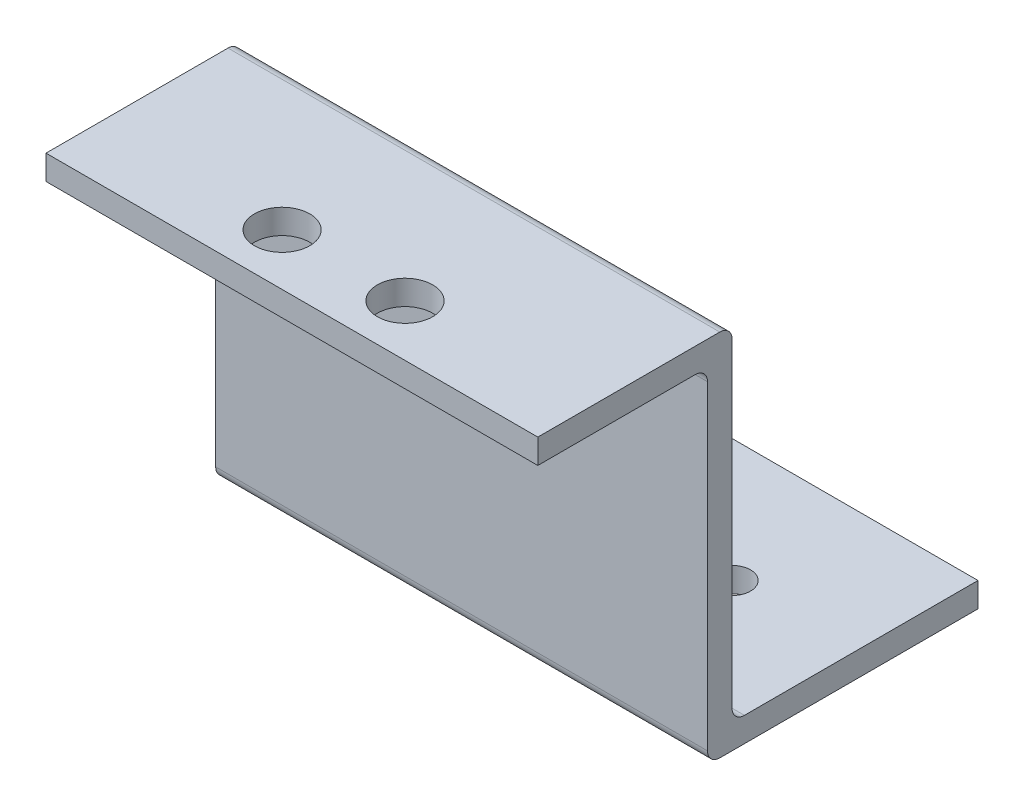
from build123d import *

# Parameters (mm, degrees)
SKETCH1_W           = 40
SKETCH1_H           = 100
SKETCH1_R           = 1.5
SKETCH1_R_2         = 2.25
BOSS_EXTRUDE1_DEPTH = 2
SKETCH2_W           = 40
SKETCH2_H           = 16
CUT_EXTRUDE1_DEPTH  = 10
SKETCH4_W           = 40
SKETCH4_H           = 2
BOSS_EXTRUDE2_DEPTH = 30
SKETCH5_W           = 40
SKETCH5_H           = 2
BOSS_EXTRUDE3_DEPTH = 20
SKETCH6_W           = 40
SKETCH6_H           = 2
BOSS_EXTRUDE4_DEPTH = 20
FILLET1_R           = 1
SKETCH7_R           = 1.5
CUT_EXTRUDE2_DEPTH  = 20
SKETCH8_R           = 1.5
CUT_EXTRUDE3_DEPTH  = 20
SKETCH9_R           = 2.25
CUT_EXTRUDE4_DEPTH  = 68.136662164
SKETCH10_W          = 1
SKETCH10_H          = 6.8
BOSS_EXTRUDE5_DEPTH = 2
BOSS_EXTRUDE6_START = -2
BOSS_EXTRUDE6_DEPTH = 2


with BuildPart() as part:
    # Sketch1 → Boss-Extrude1 (new body)
    with BuildSketch(Plane(origin=(0, 0, 0), x_dir=(1, 0, 0), z_dir=(0, 1, 0))):
        with Locations((0.735982487, -0.367991244)):
            Rectangle(SKETCH1_W, SKETCH1_H)
        with Locations(Location((-9.264017513, -40.367991244, 0), (0, 0, 270))):
            Circle(SKETCH1_R, mode=Mode.SUBTRACT)
        with Locations(Location((-4.264017513, -24.767991244, 0), (0, 0, 270))):
            Circle(SKETCH1_R_2, mode=Mode.SUBTRACT)
        with Locations(Location((10.735982487, -40.367991244, 0), (0, 0, 270))):
            Circle(SKETCH1_R, mode=Mode.SUBTRACT)
        with Locations(Location((5.735982487, -24.767991244, 0), (0, 0, 270))):
            Circle(SKETCH1_R_2, mode=Mode.SUBTRACT)
        with Locations(Location((-4.264017513, 24.032008756, 0), (0, 0, 270))):
            Circle(SKETCH1_R_2, mode=Mode.SUBTRACT)
        with Locations(Location((-9.264017513, 39.632008756, 0), (0, 0, 270))):
            Circle(SKETCH1_R, mode=Mode.SUBTRACT)
        Polygon((0.235982487, 26.632008756), (0.735982487, 26.632008756), (1.235982487, 26.632008756), (1.235982487, 19.832008756), (10.735982487, 19.832008756), (10.735982487, -20.567991244), (1.235982487, -20.567991244), (1.235982487, -27.367991244), (0.735982487, -27.367991244), (0.235982487, -27.367991244), (0.235982487, -20.567991244), (-9.264017513, -20.567991244), (-9.264017513, 19.832008756), (0.235982487, 19.832008756), align=None, mode=Mode.SUBTRACT)
        with Locations(Location((5.735982487, 24.032008756, 0), (0, 0, 270))):
            Circle(SKETCH1_R_2, mode=Mode.SUBTRACT)
        with Locations(Location((10.735982487, 39.632008756, 0), (0, 0, 270))):
            Circle(SKETCH1_R, mode=Mode.SUBTRACT)
    extrude(amount=BOSS_EXTRUDE1_DEPTH)

    # Sketch2 → Cut-Extrude1 (cut)
    with BuildSketch(Plane(origin=(0, 2, 0), x_dir=(1, 0, 0), z_dir=(0, 1, 0))):
        with Locations((0.735982487, 41.632008756)):
            Rectangle(SKETCH2_W, SKETCH2_H)
        with Locations((0.735982487, -42.367991244)):
            Rectangle(SKETCH2_W, SKETCH2_H)
    extrude(amount=-CUT_EXTRUDE1_DEPTH, mode=Mode.SUBTRACT)

    # Sketch4 → Boss-Extrude2 (add)
    with BuildSketch(Plane(origin=(0, 2, 0), x_dir=(1, 0, 0), z_dir=(0, 1, 0))):
        with Locations((0.735982487, -35.367991244)):
            Rectangle(SKETCH4_W, SKETCH4_H)
        with Locations((0.735982487, 34.632008756)):
            Rectangle(SKETCH4_W, SKETCH4_H)
    extrude(amount=-BOSS_EXTRUDE2_DEPTH)

    # Sketch5 → Boss-Extrude3 (add)
    with BuildSketch(Plane(origin=(0, 0, -35.632008756), x_dir=(-1, 0, 0), z_dir=(0, 0, -1))):
        with Locations((-0.735982487, -27)):
            Rectangle(SKETCH5_W, SKETCH5_H)
    extrude(amount=BOSS_EXTRUDE3_DEPTH)

    # Sketch6 → Boss-Extrude4 (add)
    with BuildSketch(Plane.XY.offset(36.367991244)):
        with Locations((0.735982487, -27)):
            Rectangle(SKETCH6_W, SKETCH6_H)
    extrude(amount=BOSS_EXTRUDE4_DEPTH)

    # Fillet1
    fillet1_edges = [part.edges().sort_by_distance(p)[0] for p in [
        (0.735982487, -28, 34.367991244),
        (0.735982487, 2, 36.367991244),
        (0.735982487, -28, -33.632008756),
        (0.735982487, 2, -35.632008756),
        (0.735982487, -26, -35.632008756),
        (0.735982487, -26, 36.367991244),
        (0.735982487, 0, 34.367991244),
        (0.735982487, 0, -33.632008756),
    ]]
    fillet(fillet1_edges, radius=FILLET1_R)

    # Sketch7 → Cut-Extrude2 (cut)
    with BuildSketch(Plane(origin=(0, -26, 0), x_dir=(1, 0, 0), z_dir=(0, 1, 0))):
        with Locations(Location((-9.264017513, 45.632008756, 0), (0, 0, 270))):
            Circle(SKETCH7_R)
        with Locations(Location((10.735982487, 45.632008756, 0), (0, 0, 270))):
            Circle(SKETCH7_R)
    extrude(amount=-CUT_EXTRUDE2_DEPTH, mode=Mode.SUBTRACT)

    # Sketch8 → Cut-Extrude3 (cut)
    with BuildSketch(Plane(origin=(0, -26, 0), x_dir=(1, 0, 0), z_dir=(0, 1, 0))):
        with Locations(Location((10.735982487, -46.367991244, 0), (0, 0, 270))):
            Circle(SKETCH8_R)
        with Locations(Location((-9.264017513, -46.367991244, 0), (0, 0, 270))):
            Circle(SKETCH8_R)
    extrude(amount=-CUT_EXTRUDE3_DEPTH, mode=Mode.SUBTRACT)

    # Sketch9 → Cut-Extrude4 (cut, through all)
    # profile 1 of 5: a face of its own
    with BuildSketch(Plane(origin=(0, 2, 0), x_dir=(1, 0, 0), z_dir=(0, 1, 0))):
        Polygon((36.675013235, 19.832008756), (20.735982487, 19.832008756), (20.735982487, -35.367991244), (10.735982487, -35.367991244), (10.735982487, -99.31179038), (10.735982487, -106.86631097), (36.675013235, -106.86631097), align=None)
    # profile 2 of 5: a face of its own
    with BuildSketch(Plane(origin=(0, 2, 0), x_dir=(1, 0, 0), z_dir=(0, 1, 0))):
        Polygon((10.735982487, -20.567991244), (10.735982487, 19.832008756), (1.235982487, 19.832008756), (0.235982487, 19.832008756), (-9.264017513, 19.832008756), (-9.264017513, -20.567991244), (0.235982487, -20.567991244), (0.235982487, -27.367991244), (1.235982487, -27.367991244), (1.235982487, -20.567991244), align=None)
    # profile 3 of 5: a face of its own
    with BuildSketch(Plane(origin=(0, 2, 0), x_dir=(1, 0, 0), z_dir=(0, 1, 0))):
        Polygon((10.735982487, -35.367991244), (10.735982487, -20.567991244), (1.235982487, -20.567991244), (1.235982487, -27.367991244), (0.235982487, -27.367991244), (0.235982487, -20.567991244), (-9.264017513, -20.567991244), (-9.264017513, 19.832008756), (-19.264017513, 19.832008756), (-19.264017513, -35.367991244), align=None)
        with Locations((-4.264017513, -24.767991244)):
            Circle(SKETCH9_R, mode=Mode.SUBTRACT)
        with Locations((5.735982487, -24.767991244)):
            Circle(SKETCH9_R, mode=Mode.SUBTRACT)
    # profile 4 of 5: a face of its own
    with BuildSketch(Plane(origin=(0, 2, 0), x_dir=(1, 0, 0), z_dir=(0, 1, 0))):
        Polygon((20.735982487, 19.832008756), (10.735982487, 19.832008756), (10.735982487, -20.567991244), (10.735982487, -35.367991244), (20.735982487, -35.367991244), align=None)
    # profile 5 of 5: a face of its own
    with BuildSketch(Plane(origin=(0, 2, 0), x_dir=(1, 0, 0), z_dir=(0, 1, 0))):
        Polygon((10.735982487, -99.31179038), (10.735982487, -35.367991244), (-19.264017513, -35.367991244), (-19.264017513, 19.832008756), (-32.318048619, 19.832008756), (-32.318048619, -99.31179038), align=None)
    extrude(amount=-CUT_EXTRUDE4_DEPTH, mode=Mode.SUBTRACT)

    # Sketch10 → Boss-Extrude5 (add)
    with BuildSketch(Plane(origin=(0, 2, 0), x_dir=(1, 0, 0), z_dir=(0, 1, 0))):
        with Locations((0.735982487, 23.232008756)):
            Rectangle(SKETCH10_W, SKETCH10_H)
    extrude(amount=-BOSS_EXTRUDE5_DEPTH)

    # Sketch11 → Boss-Extrude6 (add)
    with BuildSketch(Plane.ZY.offset(19.264017513).offset(BOSS_EXTRUDE6_START)):
        with BuildLine():
            Line((-35.632008756, -25), (-35.632008756, -16))
            Line((-35.632008756, -16), (-45.632008756, -26))
            Line((-45.632008756, -26), (-36.632008756, -26))
            ThreePointArc((-36.632008756, -26), (-37.339115537, -24.292893219), (-35.632008756, -25))
        make_face()
        with BuildLine():
            ThreePointArc((-36.632008756, -26), (-35.924901975, -25.707106781), (-35.632008756, -25))
            ThreePointArc((-35.632008756, -25), (-37.339115537, -24.292893219), (-36.632008756, -26))
        make_face()
    extrude(amount=BOSS_EXTRUDE6_DEPTH)


solid = part.part
